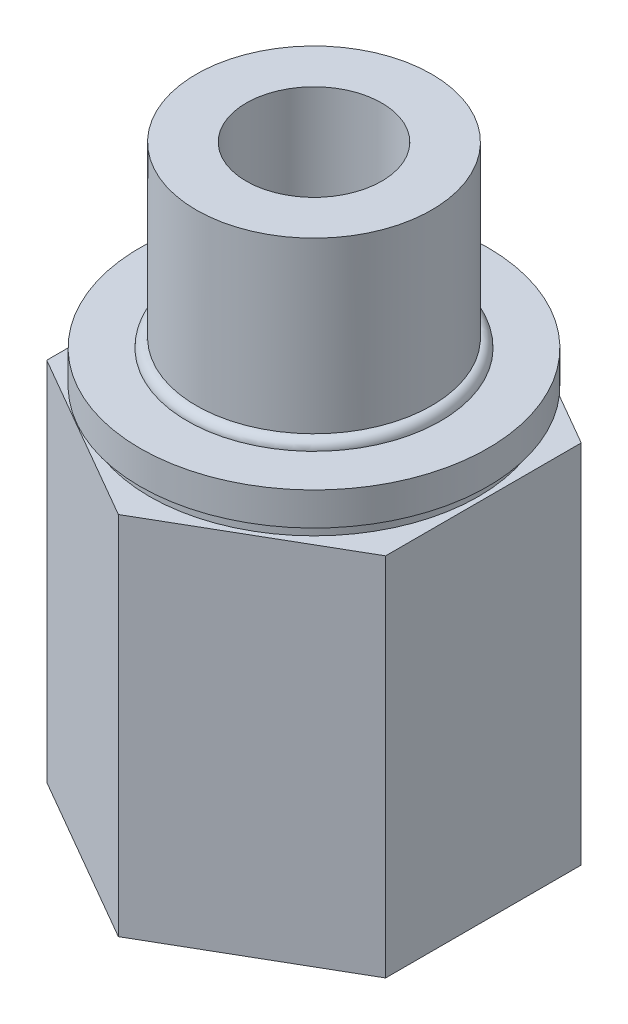
from build123d import *

# Parameters (mm, degrees)
BOSS_EXTRUDE1_DEPTH = 20.5
SKETCH2_R           = 9.225
BOSS_EXTRUDE2_DEPTH = 0.75
SKETCH3_R           = 9.75
BOSS_EXTRUDE3_DEPTH = 1.85
SKETCH4_R           = 6.6
BOSS_EXTRUDE4_DEPTH = 10
SKETCH5_R           = 3.8
CUT_EXTRUDE1_DEPTH  = 37.207814534
SKETCH6_R           = 5.5
CUT_EXTRUDE2_DEPTH  = 16.5


with BuildPart() as part:
    # Sketch1 → Boss-Extrude1 (new body)
    with BuildSketch(Plane(origin=(0, 0, 0), x_dir=(1, 0, 0), z_dir=(0, 1, 0))):
        Polygon((-9.5, 5.484827557), (-9.5, -5.484827557), (0, -10.969655115), (9.5, -5.484827557), (9.5, 5.484827557), (0, 10.969655115), align=None)
    extrude(amount=BOSS_EXTRUDE1_DEPTH)

    # Sketch2 → Boss-Extrude2 (add)
    with BuildSketch(Plane(origin=(0, 20.5, 0), x_dir=(1, 0, 0), z_dir=(0, 1, 0))):
        with Locations(Location((0, 0, 0), (0, 0, 270))):
            Circle(SKETCH2_R)
    extrude(amount=BOSS_EXTRUDE2_DEPTH)

    # Sketch3 → Boss-Extrude3 (add)
    with BuildSketch(Plane(origin=(0, 21.25, 0), x_dir=(1, 0, 0), z_dir=(0, 1, 0))):
        with Locations(Location((0, 0, 0), (0, 0, 270))):
            Circle(SKETCH3_R)
    extrude(amount=BOSS_EXTRUDE3_DEPTH)

    # Sketch4 → Boss-Extrude4 (add)
    with BuildSketch(Plane(origin=(0, 23.1, 0), x_dir=(1, 0, 0), z_dir=(0, 1, 0))):
        with Locations(Location((0, 0, 0), (0, 0, 270))):
            Circle(SKETCH4_R)
    extrude(amount=BOSS_EXTRUDE4_DEPTH)

    # Sketch5 → Cut-Extrude1 (cut, through all)
    with BuildSketch(Plane(origin=(0, 33.1, 0), x_dir=(1, 0, 0), z_dir=(0, 1, 0))):
        with Locations(Location((0, 0, 0), (0, 0, 270))):
            Circle(SKETCH5_R)
    extrude(amount=-CUT_EXTRUDE1_DEPTH, mode=Mode.SUBTRACT)

    # Sketch6 → Cut-Extrude2 (cut)
    with BuildSketch(Plane.XZ):
        with Locations(Location((0, 0, 0), (0, 0, 270))):
            Circle(SKETCH6_R)
    extrude(amount=-CUT_EXTRUDE2_DEPTH, mode=Mode.SUBTRACT)

    # Sketch7 → Revolve1 (revolve)
    with BuildSketch(Plane.XY, mode=Mode.PRIVATE) as revolve1_sk:
        with BuildLine():
            Line((-6.6, 23.6), (-6.6, 23.1))
            Line((-6.6, 23.1), (-7.1, 23.1))
            ThreePointArc((-7.1, 23.1), (-6.953553391, 23.453553391), (-6.6, 23.6))
        make_face()
    revolve(revolve1_sk.sketch.rotate(Axis((0, 0, 0), (0, 1, 0)), 270), axis=Axis((0, 0, 0), (0, 1, 0)))


solid = part.part
